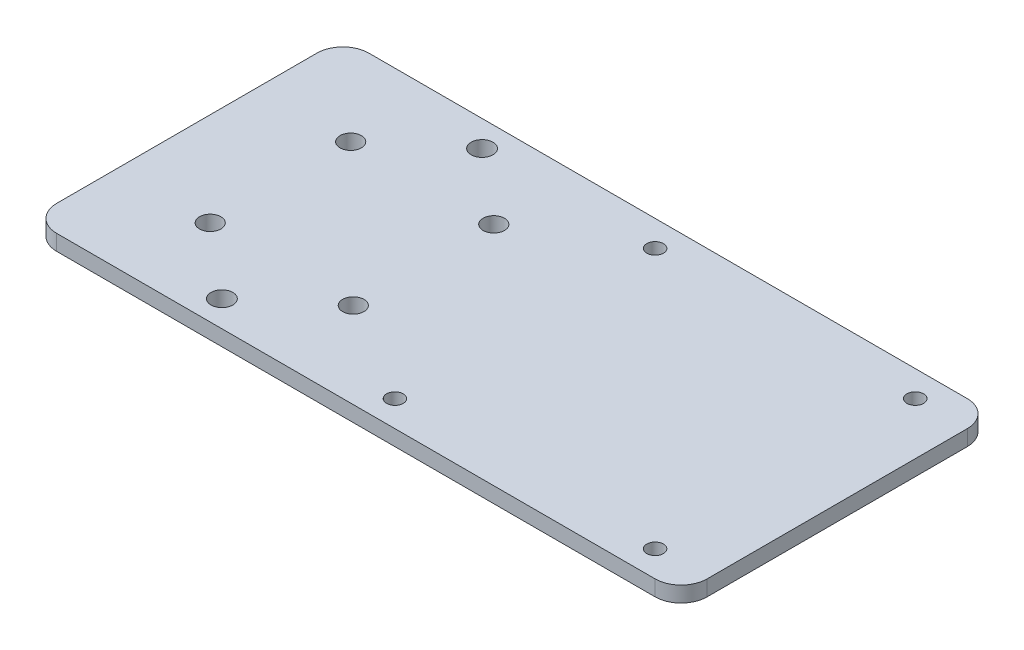
from build123d import *

# Parameters (mm, degrees)
SKETCH_1_W          = 125
SKETCH_1_H          = 60
EXTRUDE_1_DEPTH     = 3
SKETCH_2_R          = 2.05
SKETCH_2_R_2        = 2.1
CUT_EXTRUDE_1_DEPTH = 267.924326413
SKETCH_3_R          = 1.6
CUT_EXTRUDE_2_DEPTH = 267.924326413
FILLET_1_R          = 5


with BuildPart() as part:
    # 草图1 → 凸台-拉伸1 (new body)
    with BuildSketch(Plane(origin=(0, 0, 0), x_dir=(1, 0, 0), z_dir=(0, 1, 0))):
        with Locations((-183.941364286, 72.5)):
            Rectangle(SKETCH_1_W, SKETCH_1_H)
    extrude(amount=EXTRUDE_1_DEPTH)

    # 草图2 → 切除-拉伸1 (cut, through all)
    with BuildSketch(Plane(origin=(0, 3, 0), x_dir=(1, 0, 0), z_dir=(0, 1, 0))):
        with Locations(Location((-228.441364286, 86, 0), (0, 0, 270))):
            Circle(SKETCH_2_R)
        with Locations(Location((-228.441364286, 59, 0), (0, 0, 270))):
            Circle(SKETCH_2_R)
        with Locations(Location((-200.941364286, 86, 0), (0, 0, 270))):
            Circle(SKETCH_2_R)
        with Locations(Location((-200.941364286, 59, 0), (0, 0, 90))):
            Circle(SKETCH_2_R)
        with Locations(Location((-214.691364286, 97.5, 0), (0, 0, 270))):
            Circle(SKETCH_2_R_2)
        with Locations(Location((-214.691364286, 47.5, 0), (0, 0, 90))):
            Circle(SKETCH_2_R_2)
    extrude(amount=-CUT_EXTRUDE_1_DEPTH, mode=Mode.SUBTRACT)

    # 草图3 → 切除-拉伸2 (cut, through all)
    with BuildSketch(Plane(origin=(0, 3, 0), x_dir=(1, 0, 0), z_dir=(0, 1, 0))):
        with Locations(Location((-181.441364286, 97.5, 0), (0, 0, 270))):
            Circle(SKETCH_3_R)
        with Locations(Location((-131.441364286, 97.5, 0), (0, 0, 270))):
            Circle(SKETCH_3_R)
        with Locations(Location((-131.441364286, 47.5, 0), (0, 0, 90))):
            Circle(SKETCH_3_R)
        with Locations(Location((-181.441364286, 47.5, 0), (0, 0, 90))):
            Circle(SKETCH_3_R)
    extrude(amount=-CUT_EXTRUDE_2_DEPTH, mode=Mode.SUBTRACT)

    # 圆角1
    fillet_1_edges = [part.edges().sort_by_distance(p)[0] for p in [
        (-121.441364286, 1.5, -42.5),
        (-246.441364286, 1.5, -42.5),
        (-246.441364286, 1.5, -102.5),
        (-121.441364286, 1.5, -102.5),
    ]]
    fillet(fillet_1_edges, radius=FILLET_1_R)


solid = part.part
